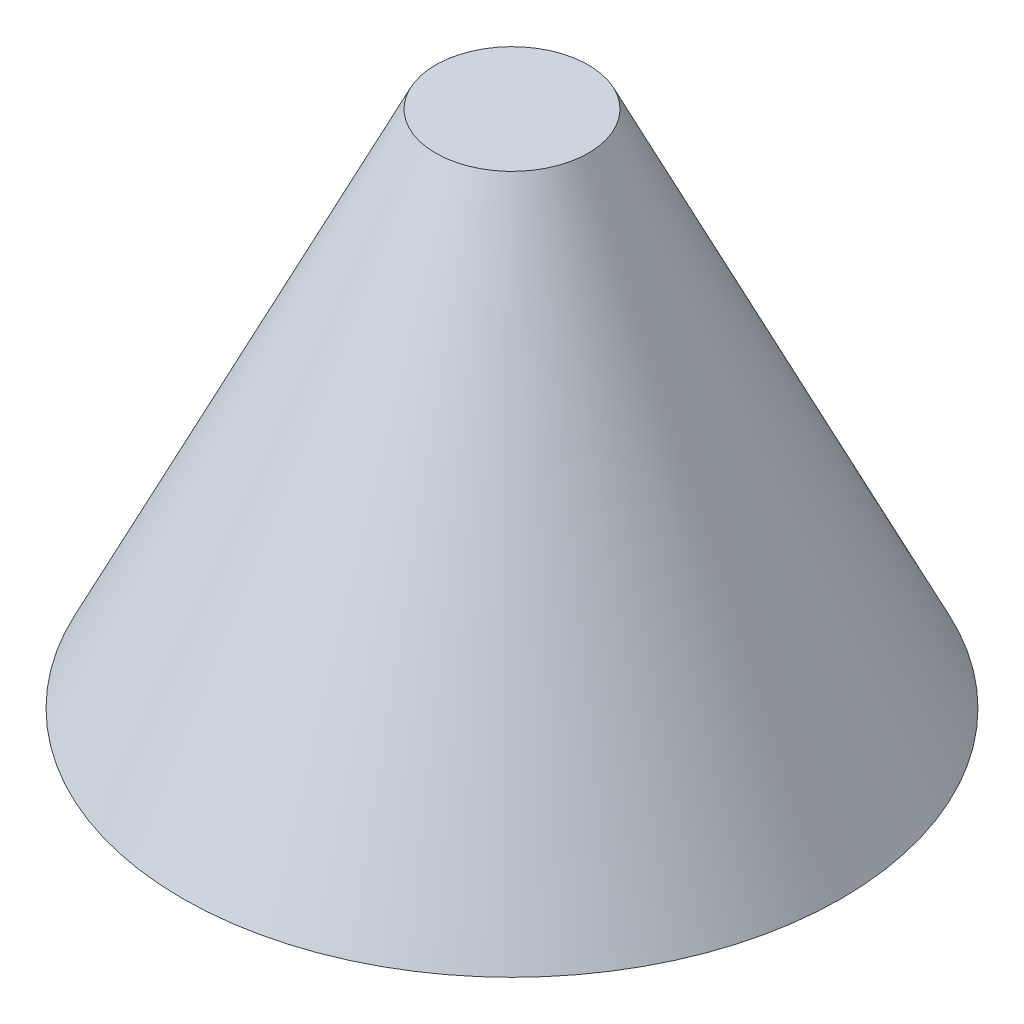
from build123d import *

# Parameters (mm, degrees)
SKETCH1_R           = 50.8
BOSS_EXTRUDE1_DEPTH = 80.01
BOSS_EXTRUDE1_TAPER = 26


with BuildPart() as part:
    # Sketch1 → Boss-Extrude1 (new body)
    with BuildSketch(Plane(origin=(0, 0, 0), x_dir=(1, 0, 0), z_dir=(0, 1, 0))):
        Circle(SKETCH1_R)
    extrude(amount=BOSS_EXTRUDE1_DEPTH, taper=BOSS_EXTRUDE1_TAPER)


solid = part.part
